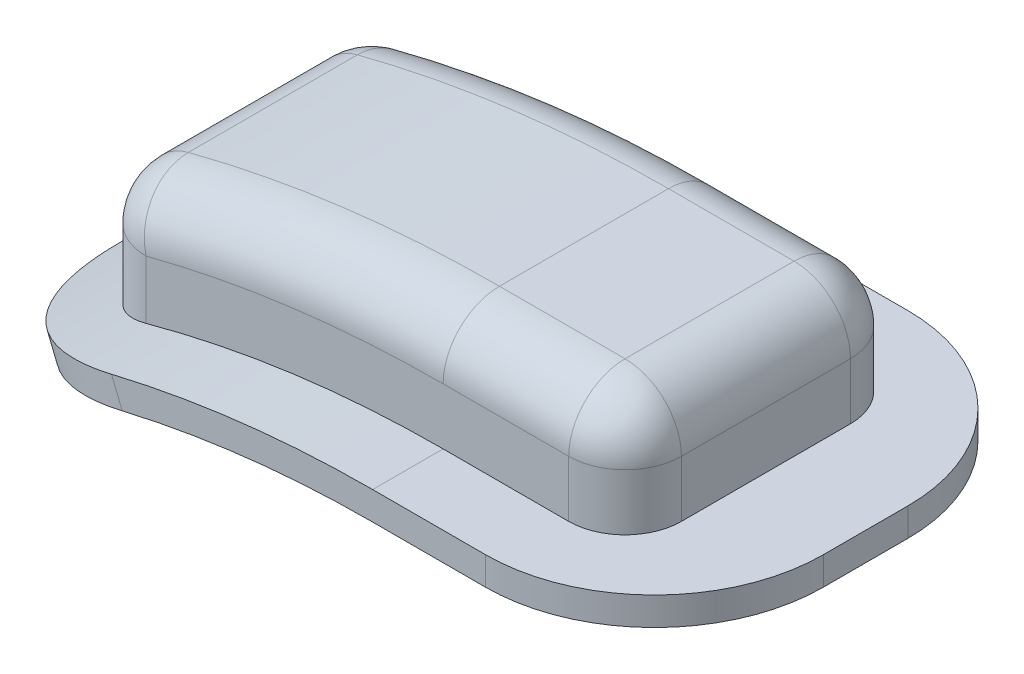
from build123d import *

# Parameters (mm, degrees)
BOSS_EXTRUDE3_DEPTH                  = 19.05
SKETCH5_R                            = 1.778
CUT_EXTRUDE1_DEPTH                   = 3.048
SKETCH7_W                            = 24.13
SKETCH7_H                            = 12.7
BOSS_EXTRUDE4_DEPTH                  = 6.35
BOSS_EXTRUDE4_DIRECTION_2_REACH      = 29.38
BOSS_EXTRUDE4_DIRECTION_2_END_RADIUS = 50.8
CUT_EXTRUDE2_DEPTH                   = 26.597668413
FILLET1_R                            = 2.54
FILLET2_R                            = 7.62


with BuildPart() as part:
    # Sketch3 → Boss-Extrude3 (new body)
    with BuildSketch(Plane.XY):
        with BuildLine():
            Line((0, 0), (12.7, 0))
            Line((12.7, 0), (12.7, -1.27))
            Line((12.7, -1.27), (0, -1.27))
            ThreePointArc((0, -1.27), (-9.461085009, -2.182011863), (-18.57375, -4.884461117))
            Line((-18.57375, -4.884461117), (-19.05, -3.707139607))
            ThreePointArc((-19.05, -3.707139607), (-9.703676933, -0.935396783), (0, 0))
        make_face()
    extrude(amount=BOSS_EXTRUDE3_DEPTH)

    # Sketch5 → Cut-Extrude1 (cut)
    with BuildSketch(Plane(origin=(0, -3.81, 0), x_dir=(-1, 0, 0), z_dir=(0, -1, 0))):
        with Locations(Location((4.49834, -9.525, 0), (0, 0, 90))):
            Circle(SKETCH5_R)
    extrude(amount=-CUT_EXTRUDE1_DEPTH, mode=Mode.SUBTRACT)

    # Sketch7 → Boss-Extrude4 (add)
    with BuildSketch(Plane(origin=(0, 0, 0), x_dir=(1, 0, 0), z_dir=(0, 1, 0))):
        with Locations((-3.86334, -9.525)):
            Rectangle(SKETCH7_W, SKETCH7_H)
    extrude(amount=BOSS_EXTRUDE4_DEPTH)

    # Boss-Extrude4 direction 2: up to this cylinder (the profile starts outside it)
    boss_extrude4_direction_2_end = Plane(origin=(0, -50.8, 9.525), z_dir=(0, 0, -1)) * Cylinder(BOSS_EXTRUDE4_DIRECTION_2_END_RADIUS, 161.36, mode=Mode.PRIVATE)
    # Sketch7 → Boss-Extrude4 direction 2 (add, up to the surface)
    with BuildSketch(Plane(origin=(0, 0, 0), x_dir=(1, 0, 0), z_dir=(0, 1, 0)), mode=Mode.PRIVATE) as boss_extrude4_direction_2_sk1:
        with Locations((-3.86334, -9.525)):
            Rectangle(SKETCH7_W, SKETCH7_H)
    boss_extrude4_direction_2_tool1 = extrude(boss_extrude4_direction_2_sk1.sketch, amount=-BOSS_EXTRUDE4_DIRECTION_2_REACH, mode=Mode.PRIVATE) - boss_extrude4_direction_2_end
    add(boss_extrude4_direction_2_tool1.solids().sort_by_distance((-3.86334, 0, 9.525))[0])
    add(boss_extrude4_direction_2_tool1.solids().sort_by_distance((-3.86334, 0, 9.525))[1])

    # Sketch8 → Cut-Extrude2 (cut, through all)
    with BuildSketch(Plane.XY.offset(15.875)):
        with BuildLine():
            Line((8.20166, 5.08), (8.20166, 6.35))
            Line((8.20166, 6.35), (-20.955, 6.35))
            Line((-20.955, 6.35), (-20.955, 1.002146432))
            ThreePointArc((-20.955, 1.002146432), (-10.674044626, 4.051063539), (0, 5.08))
            Line((0, 5.08), (8.20166, 5.08))
        make_face()
    extrude(amount=-CUT_EXTRUDE2_DEPTH, mode=Mode.SUBTRACT)

    # Fillet1
    fillet1_edges = [part.edges().sort_by_distance(p)[0] for p in [
        (-15.92834, 0.100002136, 3.175),
        (-15.92834, 0.100002136, 15.875),
        (8.20166, 2.54, 3.175),
        (8.20166, 2.54, 15.875),
        (-15.92834, 2.761762339, 9.525),
        (-8.048078047, 4.497403553, 3.175),
        (4.10083, 5.08, 3.175),
        (8.20166, 5.08, 9.525),
        (-8.048078047, 4.497403553, 15.875),
        (4.10083, 5.08, 15.875),
    ]]
    fillet(fillet1_edges, radius=FILLET1_R)

    # Fillet2
    fillet2_edges = [part.edges().sort_by_distance(p)[0] for p in [
        (-18.811875, -4.295800362, 19.05),
        (-18.811875, -4.295800362, 0),
        (12.7, -0.635, 19.05),
        (12.7, -0.635, 0),
    ]]
    fillet(fillet2_edges, radius=FILLET2_R)


solid = part.part
